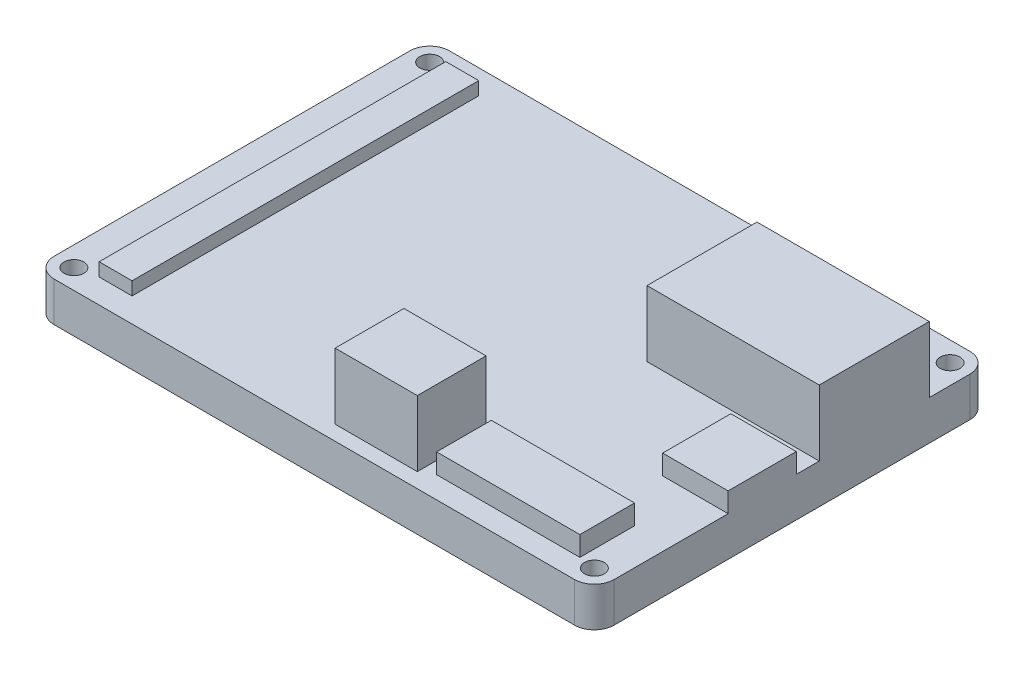
from build123d import *

# Parameters (mm, degrees)
BOSS_EXTRUDE1_DEPTH      = 3
BOSS_EXTRUDE1_DEPTH_BACK = 3
SKETCH1_R                = 1.5
SKETCH2_W                = 5
SKETCH2_H                = 52.625164332
BOSS_EXTRUDE2_DEPTH      = 5
SKETCH3_W                = 26.14370814
SKETCH3_H                = 16.696493178
BOSS_EXTRUDE3_DEPTH      = 13
SKETCH4_W                = 9.938286277
SKETCH4_H                = 10.344826846
BOSS_EXTRUDE4_DEPTH      = 6
SKETCH5_W                = 12.473423639
SKETCH5_H                = 10.432804083
BOSS_EXTRUDE5_DEPTH      = 13
SKETCH6_W                = 21.73915334
SKETCH6_H                = 8.30143682
BOSS_EXTRUDE6_DEPTH      = 6


with BuildPart() as part:
    # Sketch1 → Boss-Extrude1 (new, two sides: drawn at the far end of the back side and taken through both)
    with BuildSketch(Plane(origin=(0, 0, 0), x_dir=(1, 0, 0), z_dir=(0, 1, 0)).offset(-BOSS_EXTRUDE1_DEPTH_BACK)):
        with BuildLine():
            Line((-39.5, -30), (39.5, -30))
            ThreePointArc((39.5, -30), (41.621320344, -29.121320344), (42.5, -27))
            Line((42.5, -27), (42.5, 27))
            ThreePointArc((42.5, 27), (41.621320344, 29.121320344), (39.5, 30))
            Line((39.5, 30), (-39.5, 30))
            ThreePointArc((-39.5, 30), (-41.621320344, 29.121320344), (-42.5, 27))
            Line((-42.5, 27), (-42.5, -27))
            ThreePointArc((-42.5, -27), (-41.621320344, -29.121320344), (-39.5, -30))
        make_face()
        with Locations((-39.5, 27)):
            Circle(SKETCH1_R, mode=Mode.SUBTRACT)
        with Locations((39.5, 27)):
            Circle(SKETCH1_R, mode=Mode.SUBTRACT)
        with Locations((39.5, -27)):
            Circle(SKETCH1_R, mode=Mode.SUBTRACT)
        with Locations((-39.5, -27)):
            Circle(SKETCH1_R, mode=Mode.SUBTRACT)
    extrude(amount=BOSS_EXTRUDE1_DEPTH + BOSS_EXTRUDE1_DEPTH_BACK)

    # Sketch2 → Boss-Extrude2 (add)
    with BuildSketch(Plane(origin=(0, 0, 0), x_dir=(1, 0, 0), z_dir=(0, 1, 0))):
        with Locations((-33.860518443, 0)):
            Rectangle(SKETCH2_W, SKETCH2_H)
    extrude(amount=BOSS_EXTRUDE2_DEPTH)

    # Sketch3 → Boss-Extrude3 (add)
    with BuildSketch(Plane(origin=(0, 0, 0), x_dir=(1, 0, 0), z_dir=(0, 1, 0))):
        with Locations((29.42814593, 12.489663364)):
            Rectangle(SKETCH3_W, SKETCH3_H)
    extrude(amount=BOSS_EXTRUDE3_DEPTH)

    # Sketch4 → Boss-Extrude4 (add)
    with BuildSketch(Plane(origin=(0, 0, 0), x_dir=(1, 0, 0), z_dir=(0, 1, 0))):
        with Locations((37.530856861, -4.519547668)):
            Rectangle(SKETCH4_W, SKETCH4_H)
    extrude(amount=BOSS_EXTRUDE4_DEPTH)

    # Sketch5 → Boss-Extrude5 (add)
    with BuildSketch(Plane(origin=(0, 0, 0), x_dir=(1, 0, 0), z_dir=(0, 1, 0))):
        with Locations((7.14417266, -22.535803866)):
            Rectangle(SKETCH5_W, SKETCH5_H)
    extrude(amount=BOSS_EXTRUDE5_DEPTH)

    # Sketch6 → Boss-Extrude6 (add)
    with BuildSketch(Plane(origin=(0, 0, 0), x_dir=(1, 0, 0), z_dir=(0, 1, 0))):
        with Locations((26.117763778, -22.537195349)):
            Rectangle(SKETCH6_W, SKETCH6_H)
    extrude(amount=BOSS_EXTRUDE6_DEPTH)


solid = part.part
